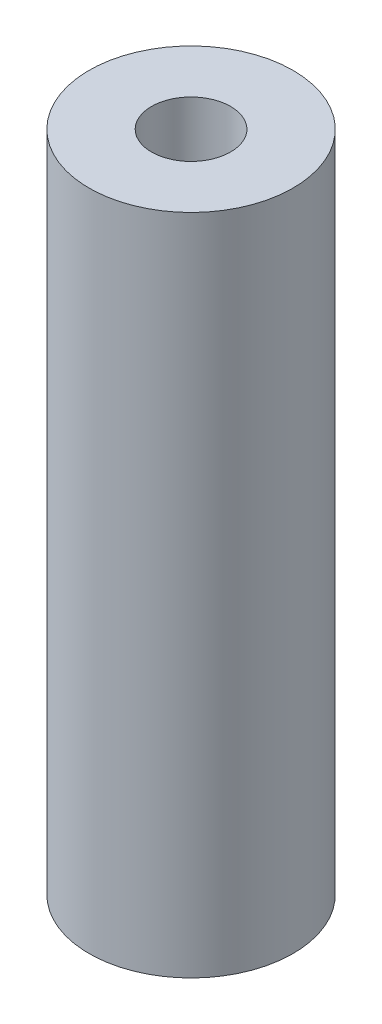
from build123d import *

# Parameters (mm, degrees)
SKETCH1_R           = 4
SKETCH1_R_2         = 1.55
BOSS_EXTRUDE1_DEPTH = 26


with BuildPart() as part:
    # Sketch1 → Boss-Extrude1 (new body)
    with BuildSketch(Plane(origin=(0, 0, 0), x_dir=(1, 0, 0), z_dir=(0, 1, 0))):
        with Locations(Location((0, 0, 0), (0, 0, 90))):
            Circle(SKETCH1_R)
        with Locations(Location((0, 0, 0), (0, 0, 90))):
            Circle(SKETCH1_R_2, mode=Mode.SUBTRACT)
    extrude(amount=BOSS_EXTRUDE1_DEPTH)


solid = part.part
